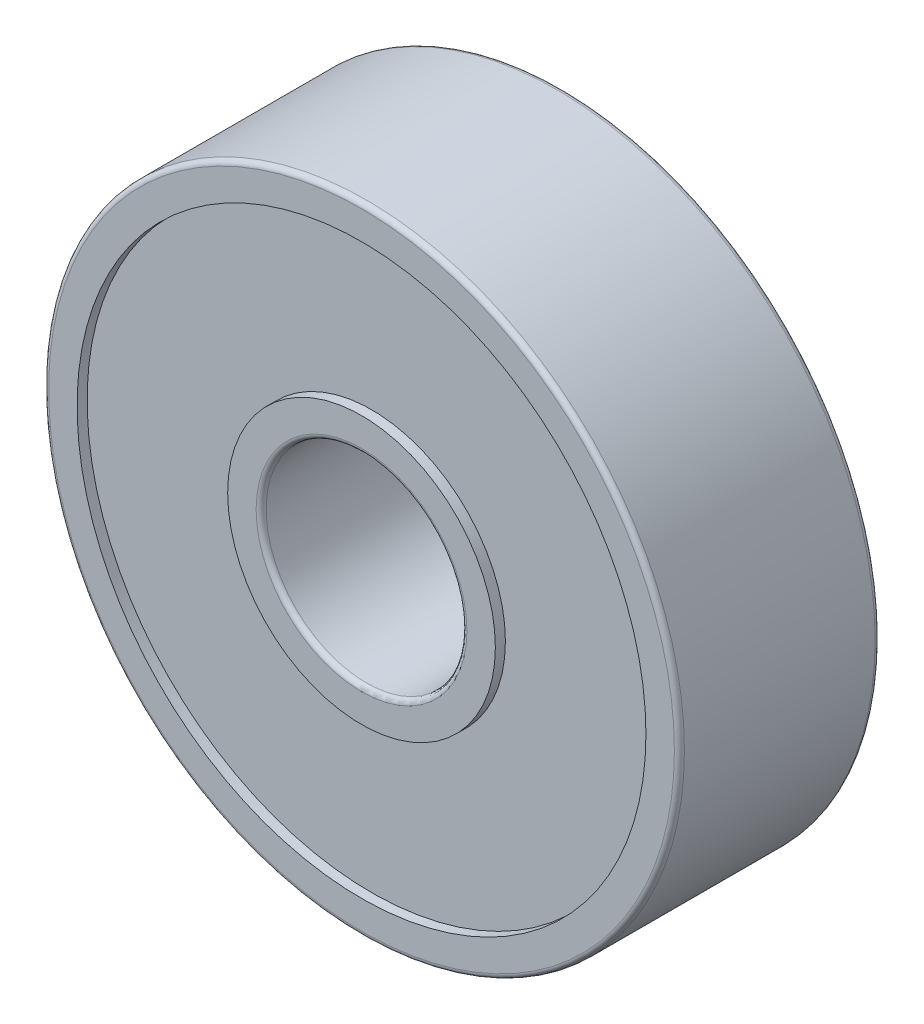
from build123d import *

# Parameters (mm, degrees)
SKETCH1_R           = 9.5
SKETCH1_R_2         = 3
BOSS_EXTRUDE1_DEPTH = 6
SKETCH2_R           = 8.5
SKETCH2_R_2         = 4
CUT_EXTRUDE1_DEPTH  = 0.3
CUT_EXTRUDE2_START  = -5.5
SKETCH2_2_R         = 8.5
SKETCH2_2_R_2       = 4
CUT_EXTRUDE2_DEPTH  = 0.5
FILLET1_R           = 0.15


with BuildPart() as part:
    # Sketch1 → Boss-Extrude1 (new body)
    with BuildSketch(Plane.XY):
        Circle(SKETCH1_R)
        Circle(SKETCH1_R_2, mode=Mode.SUBTRACT)
    extrude(amount=BOSS_EXTRUDE1_DEPTH)

    # Sketch2 → Cut-Extrude1 (cut)
    with BuildSketch(Plane.XY.offset(6)):
        Circle(SKETCH2_R)
        Circle(SKETCH2_R_2, mode=Mode.SUBTRACT)
    extrude(amount=-CUT_EXTRUDE1_DEPTH, mode=Mode.SUBTRACT)

    # Sketch2<2> → Cut-Extrude2 (cut)
    with BuildSketch(Plane.XY.offset(6).offset(CUT_EXTRUDE2_START)):
        Circle(SKETCH2_2_R)
        Circle(SKETCH2_2_R_2, mode=Mode.SUBTRACT)
    extrude(amount=-CUT_EXTRUDE2_DEPTH, mode=Mode.SUBTRACT)

    # Fillet1
    fillet1_edges = [part.edges().sort_by_distance(p)[0] for p in [
        (-9.5, 0, 0),
        (-9.5, 0, 6),
        (-3, 0, 0),
        (-3, 0, 6),
    ]]
    fillet(fillet1_edges, radius=FILLET1_R)


solid = part.part
